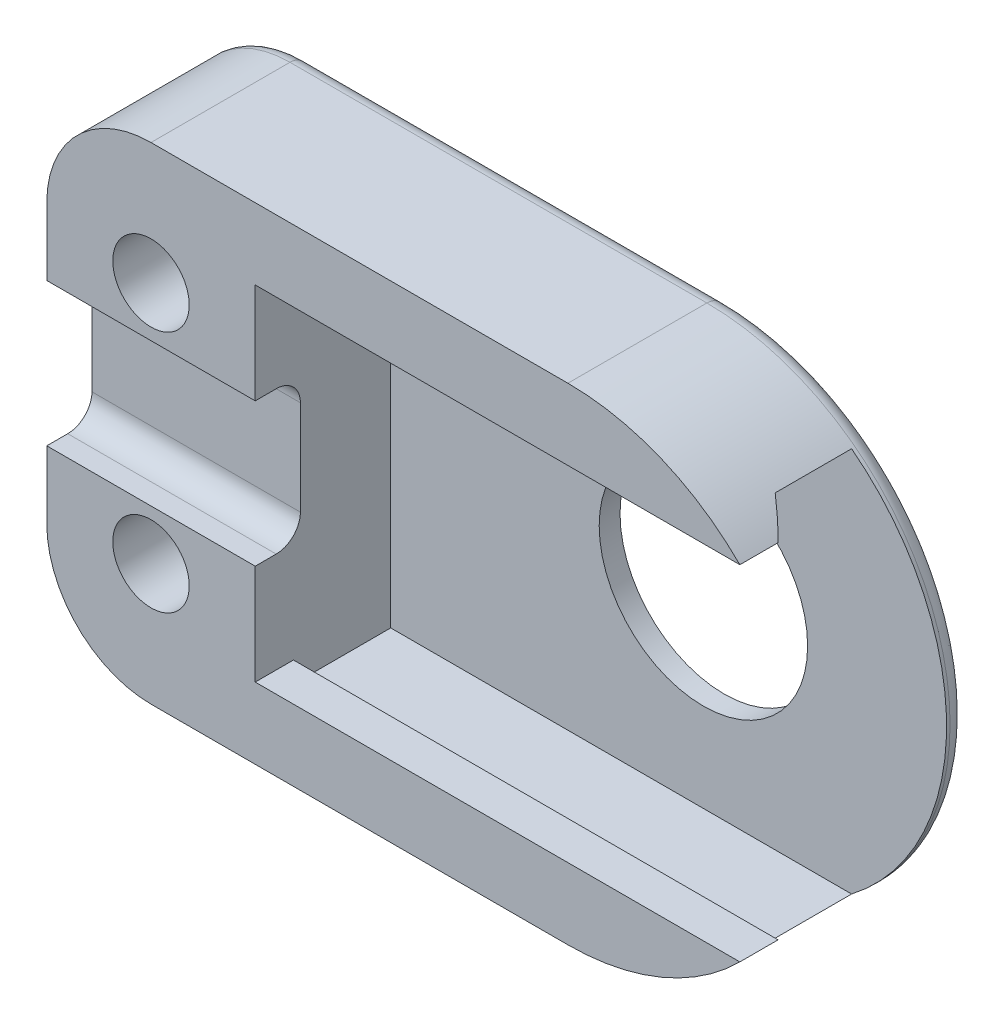
from build123d import *

# Parameters (mm, degrees)
SKETCH1_R           = 1.1
BOSS_EXTRUDE1_DEPTH = 4.5
SKETCH2_R           = 3
CUT_EXTRUDE2_DEPTH  = 10
CUT_EXTRUDE4_START  = -6
CUT_EXTRUDE4_DEPTH  = 18.521266973
CUT_EXTRUDE6_DEPTH  = 24.521266973
FILLET4_R           = 3
FILLET1_R           = 0.5
SKETCH5_R           = 1.75
CUT_EXTRUDE5_DEPTH  = 1


with BuildPart() as part:
    # Sketch1 → Boss-Extrude1 (new body)
    with BuildSketch(Plane.XY):
        with BuildLine():
            Line((-15, 7), (0, 7))
            ThreePointArc((0, 7), (7, 0), (0, -7))
            Line((0, -7), (-15, -7))
            Line((-15, -7), (-15, 7))
        make_face()
        with Locations((-12, 3.5)):
            Circle(SKETCH1_R, mode=Mode.SUBTRACT)
        with Locations(Location((-12, -3.5, 0), (0, 0, 180))):
            Circle(SKETCH1_R, mode=Mode.SUBTRACT)
    extrude(amount=BOSS_EXTRUDE1_DEPTH)

    # Sketch2 → Cut-Extrude2 (cut)
    with BuildSketch(Plane(origin=(0, 0, 0), x_dir=(-1, 0, 0), z_dir=(0, 0, -1))):
        Circle(SKETCH2_R)
    extrude(amount=-CUT_EXTRUDE2_DEPTH, mode=Mode.SUBTRACT)

    # Sketch7 → Cut-Extrude4 (cut, through all)
    with BuildSketch(Plane.ZY.offset(15).offset(CUT_EXTRUDE4_START)):
        Polygon((2.8, 5.55), (0.6, 5.55), (0.6, 0), (4.5, 0), (4.5, 4.95), (3.4, 4.95), align=None)
        Polygon((4.5, 0), (0.6, 0), (0.6, -5.55), (2.8, -5.55), (3.4, -4.95), (4.5, -4.95), align=None)
    extrude(amount=-CUT_EXTRUDE4_DEPTH, mode=Mode.SUBTRACT)

    # Sketch8 → Cut-Extrude6 (cut, through all)
    with BuildSketch(Plane.ZY.offset(15)):
        with BuildLine():
            Line((3.2, 1.363340016), (3.2, -1.363340016))
            ThreePointArc((3.2, -1.363340016), (3.404046985, -1.855953015), (3.896659984, -2.06))
            Line((3.896659984, -2.06), (4.5, -2.06))
            Line((4.5, -2.06), (4.5, 2.06))
            Line((4.5, 2.06), (3.896659984, 2.06))
            ThreePointArc((3.896659984, 2.06), (3.404046985, 1.855953015), (3.2, 1.363340016))
        make_face()
    extrude(amount=-CUT_EXTRUDE6_DEPTH, mode=Mode.SUBTRACT)

    # Fillet4
    fillet4_edges = [part.edges().sort_by_distance(p)[0] for p in [
        (-15, -7, 2.25),
        (-15, 7, 2.25),
    ]]
    fillet(fillet4_edges, radius=FILLET4_R)

    # Fillet1
    fillet1_edges = [part.edges().sort_by_distance(p)[0] for p in [
        (-6, 7, 0),
        (7, 0, 0),
        (-15, 0, 0),
        (-6, -7, 0),
        (-14.121320344, -6.121320344, 0),
        (-14.121320344, 6.121320344, 0),
    ]]
    fillet(fillet1_edges, radius=FILLET1_R)

    # Sketch5 → Cut-Extrude5 (cut)
    with BuildSketch(Plane.XY):
        with Locations((-12, 3.5)):
            Circle(SKETCH5_R)
        with Locations((-12, -3.5)):
            Circle(SKETCH5_R)
    extrude(amount=CUT_EXTRUDE5_DEPTH, mode=Mode.SUBTRACT)


solid = part.part
